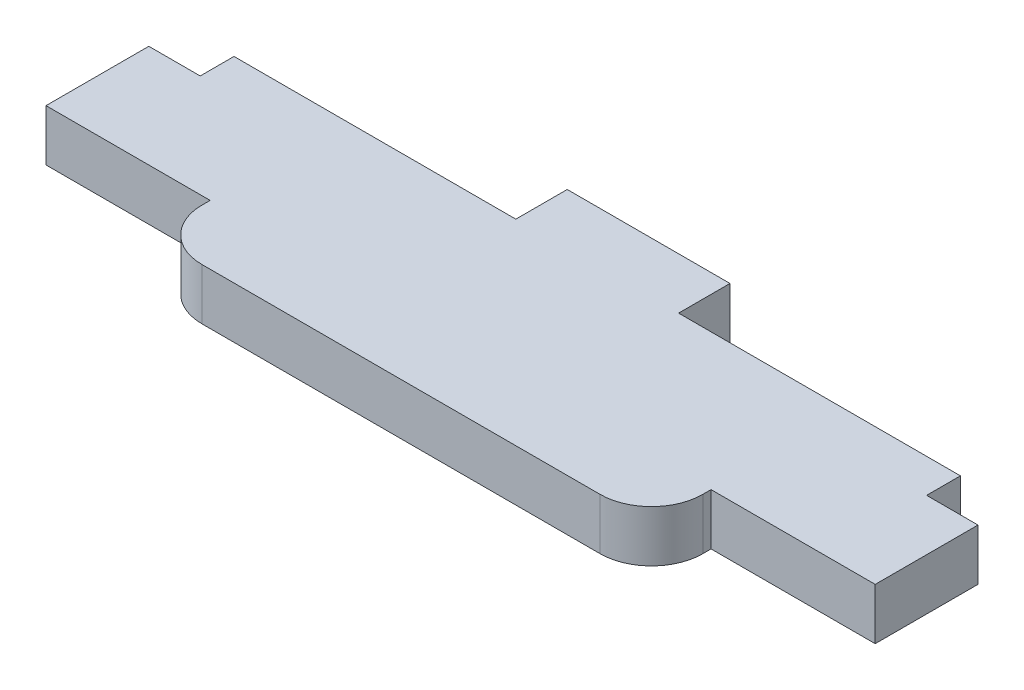
from build123d import *

# Parameters (mm, degrees)
BOSS_EXTRUDE1_DEPTH = 6


with BuildPart() as part:
    # Sketch1 → Boss-Extrude1 (new body)
    with BuildSketch(Plane(origin=(0, 0, 0), x_dir=(1, 0, 0), z_dir=(0, 1, 0))):
        with BuildLine():
            Line((40.206859082, 0.405693798), (53.496778433, 0.405693798))
            Line((53.496778433, 0.405693798), (70.087810024, 0.405693798))
            ThreePointArc((70.087810024, 0.405693798), (74.330450711, 2.163053111), (76.087810024, 6.405693798))
            Line((76.087810024, 6.405693798), (76.087810024, 7.364453077))
            Line((76.087810024, 7.364453077), (95.248908352, 7.364453077))
            Line((95.248908352, 7.364453077), (95.248908352, 19.364453077))
            Line((95.248908352, 19.364453077), (89.248908352, 19.364453077))
            Line((89.248908352, 19.364453077), (89.248908352, 23.311113477))
            Line((89.248908352, 23.311113477), (56.351818757, 23.311113477))
            Line((56.351818757, 23.311113477), (56.351818757, 29.311113477))
            Line((56.351818757, 29.311113477), (37.351818757, 29.311113477))
            Line((37.351818757, 29.311113477), (37.351818757, 23.311113477))
            Line((37.351818757, 23.311113477), (4.454729162, 23.311113477))
            Line((4.454729162, 23.311113477), (4.454729162, 19.364453077))
            Line((4.454729162, 19.364453077), (-1.545270838, 19.364453077))
            Line((-1.545270838, 19.364453077), (-1.545270838, 7.364453077))
            Line((-1.545270838, 7.364453077), (17.615827491, 7.364453077))
            Line((17.615827491, 7.364453077), (17.615827491, 6.405693798))
            ThreePointArc((17.615827491, 6.405693798), (19.373186804, 2.163053111), (23.615827491, 0.405693798))
            Line((23.615827491, 0.405693798), (40.206859082, 0.405693798))
        make_face()
    extrude(amount=BOSS_EXTRUDE1_DEPTH)


solid = part.part
